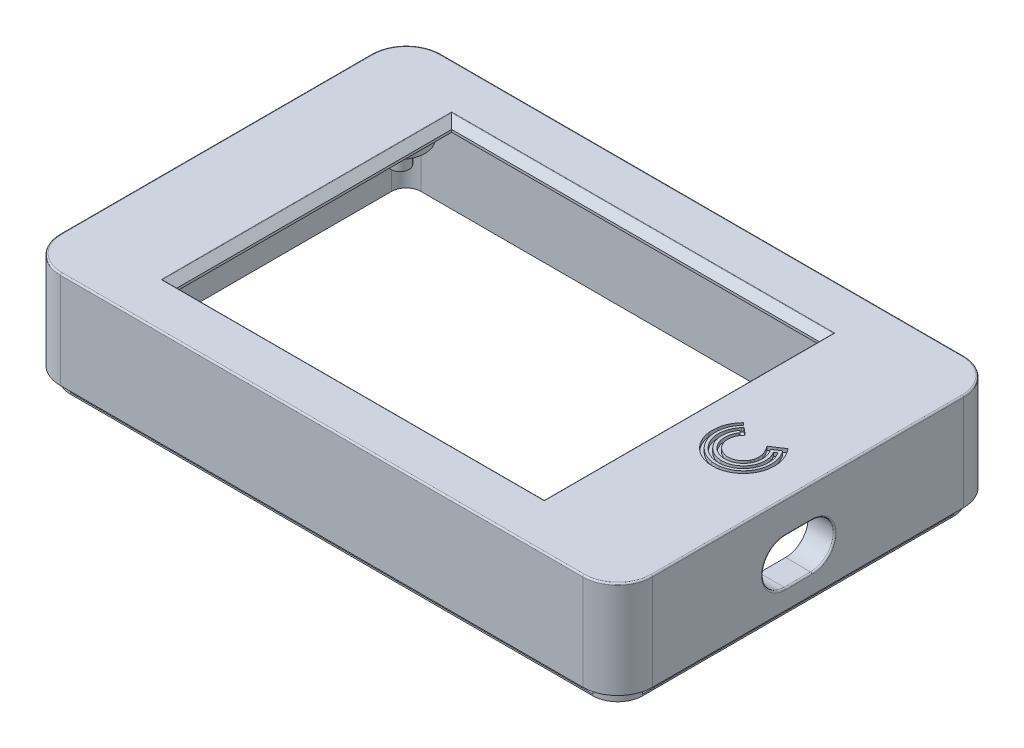
from build123d import *

# Parameters (mm, degrees)
ESQUISSE1_W                 = 92
ESQUISSE1_H                 = 58
ESQUISSE1_W_2               = 59.1
ESQUISSE1_H_2               = 44.2
BOSS_EXTRU_1_DEPTH          = 1.6
CONG_1_R                    = 4
CHANFREIN1_SIZE             = 1.2
ESQUISSE12_R                = 4
BOSS_EXTRU_2_DEPTH          = 4
ESQUISSE13_R                = 1.45
BOSS_EXTRU_3_DEPTH          = 7.5
EXTRU_MINCE3_DEPTH          = 16
EXTRU_MINCE4_DEPTH          = 14
EXTRU_MINCE4_DEPTH_BACK     = 1.6
ENL_V_MAT_EXTRU_3_OK_DEPTH  = 50
ENL_V_MAT_EXTRU_4_OK_DEPTH  = 50
ENL_V_MAT_EXTRU_5_DEPTH     = 84
ENL_V_MAT_EXTRU_8_DEPTH     = 0.6
EXTRU_MINCE5_DEPTH          = 4.25
ENL_V_MAT_EXTRU_11_OK_DEPTH = 4
ENL_V_MAT_EXTRU_15_DEPTH    = 84
CONG_2_R                    = 1
CONG_3_R                    = 0.25
CONG_4_R                    = 0.25
CONG_5_R                    = 0.125


with BuildPart() as part:
    # Esquisse1 → Boss.-Extru.1 (new body)
    with BuildSketch(Plane(origin=(0, 0, 0), x_dir=(1, 0, 0), z_dir=(0, 1, 0))):
        Rectangle(ESQUISSE1_W, ESQUISSE1_H)
        with Locations((-2.25, 0)):
            Rectangle(ESQUISSE1_W_2, ESQUISSE1_H_2, mode=Mode.SUBTRACT)
    extrude(amount=BOSS_EXTRU_1_DEPTH)

    # Congé1
    cong_1_edges = [part.edges().sort_by_distance(p)[0] for p in [
        (46, 0.8, 29),
        (-46, 0.8, 29),
        (-46, 0.8, -29),
        (46, 0.8, -29),
    ]]
    fillet(cong_1_edges, radius=CONG_1_R)

    # Chanfrein1
    chanfrein1_edges = [part.edges().sort_by_distance(p)[0] for p in [
        (27.3, 1.6, 0),
        (-2.25, 1.6, -22.1),
        (-31.8, 1.6, 0),
        (-2.25, 1.6, 22.1),
    ]]
    chamfer(chanfrein1_edges, length=CHANFREIN1_SIZE)

    # Esquisse12 → Boss.-Extru.2 (add)
    with BuildSketch(Plane.XZ):
        with Locations(Location((-39, 21, 0), (0, 0, 90))):
            Circle(ESQUISSE12_R)
        with Locations(Location((-39, -21, 0), (0, 0, 90))):
            Circle(ESQUISSE12_R)
        with Locations(Location((39, 21, 0), (0, 0, 90))):
            Circle(ESQUISSE12_R)
        with Locations(Location((39, -21, 0), (0, 0, 90))):
            Circle(ESQUISSE12_R)
    extrude(amount=BOSS_EXTRU_2_DEPTH)

    # Esquisse13 → Boss.-Extru.3 (add)
    with BuildSketch(Plane.XZ):
        with Locations(Location((-39, 21, 0), (0, 0, 270))):
            Circle(ESQUISSE13_R)
        with Locations(Location((-39, -21, 0), (0, 0, 270))):
            Circle(ESQUISSE13_R)
        with Locations(Location((39, -21, 0), (0, 0, 270))):
            Circle(ESQUISSE13_R)
        with Locations(Location((39, 21, 0), (0, 0, 270))):
            Circle(ESQUISSE13_R)
    extrude(amount=BOSS_EXTRU_3_DEPTH)

    # Esquisse32 → Extru.-Mince3 (add)
    with BuildSketch(Plane.XZ):
        with BuildLine():
            Line((46, -25), (46, 25))
            ThreePointArc((46, 25), (44.828427125, 27.828427125), (42, 29))
            Line((42, 29), (-42, 29))
            ThreePointArc((-42, 29), (-44.828427125, 27.828427125), (-46, 25))
            Line((-46, 25), (-46, -25))
            ThreePointArc((-46, -25), (-44.828427125, -27.828427125), (-42, -29))
            Line((-42, -29), (42, -29))
            ThreePointArc((42, -29), (44.828427125, -27.828427125), (46, -25))
        make_face()
        with BuildLine():
            Line((44.4, -25), (44.4, 25))
            ThreePointArc((44.4, 25), (43.697056275, 26.697056275), (42, 27.4))
            Line((42, 27.4), (-42, 27.4))
            ThreePointArc((-42, 27.4), (-43.697056275, 26.697056275), (-44.4, 25))
            Line((-44.4, 25), (-44.4, -25))
            ThreePointArc((-44.4, -25), (-43.697056275, -26.697056275), (-42, -27.4))
            Line((-42, -27.4), (42, -27.4))
            ThreePointArc((42, -27.4), (43.697056275, -26.697056275), (44.4, -25))
        make_face(mode=Mode.SUBTRACT)
    extrude(amount=EXTRU_MINCE3_DEPTH)

    # Esquisse32<2> → Extru.-Mince4 (add, two sides: drawn at the far end of the back side and taken through both)
    with BuildSketch(Plane.XZ.offset(-EXTRU_MINCE4_DEPTH_BACK)):
        with BuildLine():
            Line((47.6, -25), (47.6, 25))
            ThreePointArc((47.6, 25), (45.959797975, 28.959797975), (42, 30.6))
            Line((42, 30.6), (-42, 30.6))
            ThreePointArc((-42, 30.6), (-45.959797975, 28.959797975), (-47.6, 25))
            Line((-47.6, 25), (-47.6, -25))
            ThreePointArc((-47.6, -25), (-45.959797975, -28.959797975), (-42, -30.6))
            Line((-42, -30.6), (42, -30.6))
            ThreePointArc((42, -30.6), (45.959797975, -28.959797975), (47.6, -25))
        make_face()
        with BuildLine():
            Line((46, -25), (46, 25))
            ThreePointArc((46, 25), (44.828427125, 27.828427125), (42, 29))
            Line((42, 29), (-42, 29))
            ThreePointArc((-42, 29), (-44.828427125, 27.828427125), (-46, 25))
            Line((-46, 25), (-46, -25))
            ThreePointArc((-46, -25), (-44.828427125, -27.828427125), (-42, -29))
            Line((-42, -29), (42, -29))
            ThreePointArc((42, -29), (44.828427125, -27.828427125), (46, -25))
        make_face(mode=Mode.SUBTRACT)
    extrude(amount=EXTRU_MINCE4_DEPTH + EXTRU_MINCE4_DEPTH_BACK)

    # Esquisse3D2 → Enlèv. mat.-Extru.3 ok (cut)
    with BuildSketch(Plane(origin=(-46, -15, -25), x_dir=(0, -1, 0), z_dir=(0, 0, 1))):
        Polygon((0, 0), (0.75, 0), (0, 0.75), (-0.75, 0), align=None)
    extrude(amount=ENL_V_MAT_EXTRU_3_OK_DEPTH, mode=Mode.SUBTRACT)

    # Esquisse3D3 → Enlèv. mat.-Extru.4 ok (cut)
    with BuildSketch(Plane(origin=(46, -15, -25), x_dir=(0, -1, 0), z_dir=(0, 0, -1))):
        Polygon((0, 0), (0.75, 0), (0, 0.75), (-0.75, 0), align=None)
    extrude(amount=-ENL_V_MAT_EXTRU_4_OK_DEPTH, mode=Mode.SUBTRACT)

    # Esquisse3D4 → Enlèv. mat.-Extru.5 (cut)
    with BuildSketch(Plane(origin=(42, -15, 29), x_dir=(0, 1, 0), z_dir=(-1, 0, 0))):
        Polygon((0, 0), (0.75, 0), (0, 0.75), (-0.75, 0), align=None)
    extrude(amount=ENL_V_MAT_EXTRU_5_DEPTH, mode=Mode.SUBTRACT)

    # Esquisse45 → Enlèv. mat.-Extru.8 (cut)
    with BuildSketch(Plane(origin=(0, 1.6, 0), x_dir=(1, 0, 0), z_dir=(0, 1, 0))):
        with BuildLine():
            Line((34.215771039, 2.711268822), (34.388486911, 2.91272131))
            Line((34.388486911, 2.91272131), (34.437828255, 2.87228474))
            add(Edge.make_bspline(
                [(34.993798002, 2.403405668), (34.712606668, 2.63893908), (34.463374704, 2.848535174), (34.437828255, 2.87228474)],
                knots=[24, 24, 24, 24, 25, 25, 25, 25], degree=3))
            add(Edge.make_bspline(
                [(35.53485939, 1.947487739), (35.517838447, 1.964749217), (35.274989336, 2.167872256), (34.993798002, 2.403405668)],
                knots=[23, 23, 23, 23, 24, 24, 24, 24], degree=3))
            add(Edge.make_bspline(
                [(35.407029817, 1.746965484), (35.538753823, 1.891748736), (35.558278221, 1.925895857), (35.53485939, 1.947487739)],
                knots=[22, 22, 22, 22, 23, 23, 23, 23], degree=3))
            add(Edge.make_bspline(
                [(34.73787057, 0.131736327), (34.772257454, 0.757180054), (34.985875379, 1.274228405), (35.407029817, 1.746965484)],
                knots=[21, 21, 21, 21, 22, 22, 22, 22], degree=3))
            add(Edge.make_bspline(
                [(34.824246771, -0.689545579), (34.744825467, -0.404001679), (34.720662095, -0.183128188), (34.73787057, 0.131736327)],
                knots=[20, 20, 20, 20, 21, 21, 21, 21], degree=3))
            add(Edge.make_bspline(
                [(35.655401606, -1.944604427), (35.261221021, -1.626853492), (34.962264203, -1.174776992), (34.824246771, -0.689545579)],
                knots=[19, 19, 19, 19, 20, 20, 20, 20], degree=3))
            add(Edge.make_bspline(
                [(39.451885494, -1.096996831), (38.741075896, -2.540513211), (36.903989716, -2.951889554), (35.655401606, -1.944604427)],
                knots=[18, 18, 18, 18, 19, 19, 19, 19], degree=3))
            add(Edge.make_bspline(
                [(39.626454625, -0.648242722), (39.593503049, -0.763720393), (39.514939423, -0.966731068), (39.451885494, -1.096996831)],
                knots=[17, 17, 17, 17, 18, 18, 18, 18], degree=3))
            add(Edge.make_bspline(
                [(39.68880121, -0.00799587), (39.686020024, -0.40438637), (39.681403985, -0.451494633), (39.626454625, -0.648242722)],
                knots=[16, 16, 16, 16, 17, 17, 17, 17], degree=3))
            add(Edge.make_bspline(
                [(39.63752714, 0.624477149), (39.687642863, 0.437705678), (39.691567363, 0.386251979), (39.68880121, -0.00799587)],
                knots=[15, 15, 15, 15, 16, 16, 16, 16], degree=3))
            add(Edge.make_bspline(
                [(39.035470632, 1.854358254), (39.381024576, 1.32481557), (39.537370861, 1.008733346), (39.63752714, 0.624477149)],
                knots=[14, 14, 14, 14, 15, 15, 15, 15], degree=3))
            add(Edge.make_bspline(
                [(38.840436356, 2.153569868), (38.905447781, 2.053832663), (38.970459207, 1.954095459), (39.035470632, 1.854358254)],
                knots=[13, 13, 13, 13, 14, 14, 14, 14], degree=3))
            add(Edge.make_bspline(
                [(39.834971581, 2.806561036), (39.503459839, 2.588897313), (39.171948097, 2.371233591), (38.840436356, 2.153569868)],
                knots=[12, 12, 12, 12, 13, 13, 13, 13], degree=3))
            add(Edge.make_bspline(
                [(40.853166171, 3.472242744), (40.84025013, 3.463762339), (40.381745676, 3.164850621), (39.834971581, 2.806561036)],
                knots=[11, 11, 11, 11, 12, 12, 12, 12], degree=3))
            add(Edge.make_bspline(
                [(41.322512824, 2.873263277), (41.110487671, 3.194021673), (40.881140907, 3.48918852), (40.853166171, 3.472242744)],
                knots=[10, 10, 10, 10, 11, 11, 11, 11], degree=3))
            add(Edge.make_bspline(
                [(42.164389591, 0.703172034), (42.039144997, 1.481871515), (41.75293095, 2.22313078), (41.322512824, 2.873263277)],
                knots=[9, 9, 9, 9, 10, 10, 10, 10], degree=3))
            add(Edge.make_bspline(
                [(42.153866183, -0.796683914), (42.211935368, -0.460678521), (42.215625692, 0.370685238), (42.164389591, 0.703172034)],
                knots=[8, 8, 8, 8, 9, 9, 9, 9], degree=3))
            add(Edge.make_bspline(
                [(41.861482067, -1.851011584), (41.977057069, -1.564693075), (42.095781964, -1.134831959), (42.153866183, -0.796683914)],
                knots=[7, 7, 7, 7, 8, 8, 8, 8], degree=3))
            add(Edge.make_bspline(
                [(39.359312247, -4.518329973), (40.505224046, -3.973538747), (41.381725142, -3.041161031), (41.861482067, -1.851011584)],
                knots=[6, 6, 6, 6, 7, 7, 7, 7], degree=3))
            add(Edge.make_bspline(
                [(38.017088329, -4.946034949), (38.532001159, -4.853223664), (38.903536749, -4.733693322), (39.359312247, -4.518329973)],
                knots=[5, 5, 5, 5, 6, 6, 6, 6], degree=3))
            add(Edge.make_bspline(
                [(36.598412598, -4.970365233), (36.900285903, -5.00676737), (37.772495339, -4.991459466), (38.017088329, -4.946034949)],
                knots=[4, 4, 4, 4, 5, 5, 5, 5], degree=3))
            add(Edge.make_bspline(
                [(34.115882809, -3.922281074), (34.823334364, -4.484361528), (35.722774766, -4.863511942), (36.598412598, -4.970365233)],
                knots=[3, 3, 3, 3, 4, 4, 4, 4], degree=3))
            add(Edge.make_bspline(
                [(33.303027532, -3.113044042), (33.492069824, -3.350073667), (33.879356418, -3.734201694), (34.115882809, -3.922281074)],
                knots=[2, 2, 2, 2, 3, 3, 3, 3], degree=3))
            add(Edge.make_bspline(
                [(32.263988871, -0.641583499), (32.360837793, -1.497222995), (32.750748881, -2.423486915), (33.303027532, -3.113044042)],
                knots=[1, 1, 1, 1, 2, 2, 2, 2], degree=3))
            add(Edge.make_bspline(
                [(32.233653114, -0.384239835), (32.237697881, -0.418552324), (32.251884635, -0.534360731), (32.263988871, -0.641583499)],
                knots=[0, 0, 0, 0, 1, 1, 1, 1], degree=3))
            add(Edge.make_bspline(
                [(32.282692015, 0.802503379), (32.249078968, 0.592749048), (32.213278941, -0.234103906), (32.233653114, -0.384239835)],
                knots=[69, 69, 69, 69, 70, 70, 70, 70], degree=3))
            add(Edge.make_bspline(
                [(33.541417478, 3.37783655), (32.863468483, 2.647627636), (32.443908362, 1.791325897), (32.282692015, 0.802503379)],
                knots=[68, 68, 68, 68, 69, 69, 69, 69], degree=3))
            add(Edge.make_bspline(
                [(33.677456854, 3.526875038), (33.632110396, 3.477195542), (33.586763937, 3.427516046), (33.541417478, 3.37783655)],
                knots=[67, 67, 67, 67, 68, 68, 68, 68], degree=3))
            add(Edge.make_bspline(
                [(33.800978961, 3.418870531), (33.759804925, 3.454872033), (33.71863089, 3.490873536), (33.677456854, 3.526875038)],
                knots=[66, 66, 66, 66, 67, 67, 67, 67], degree=3))
            add(Edge.make_bspline(
                [(34.001155446, 3.241759977), (33.95643037, 3.280643403), (33.866980217, 3.358410256), (33.800978961, 3.418870531)],
                knots=[65, 65, 65, 65, 66, 66, 66, 66], degree=3))
            add(Edge.make_bspline(
                [(34.077809825, 3.172653929), (34.052258365, 3.195689278), (34.026706906, 3.218724627), (34.001155446, 3.241759977)],
                knots=[64, 64, 64, 64, 65, 65, 65, 65], degree=3))
            add(Edge.make_bspline(
                [(33.967737833, 3.059860113), (34.004428497, 3.097458052), (34.041119161, 3.135055991), (34.077809825, 3.172653929)],
                knots=[63, 63, 63, 63, 64, 64, 64, 64], degree=3))
            add(Edge.make_bspline(
                [(32.759384434, -0.276505158), (32.680375392, 0.983990209), (33.11305412, 2.183040998), (33.967737833, 3.059860113)],
                knots=[62, 62, 62, 62, 63, 63, 63, 63], degree=3))
            add(Edge.make_bspline(
                [(36.47798738, -4.420974547), (34.41703451, -4.061530476), (32.890472222, -2.360184548), (32.759384434, -0.276505158)],
                knots=[61, 61, 61, 61, 62, 62, 62, 62], degree=3))
            add(Edge.make_bspline(
                [(37.720574831, -4.451120456), (37.379577563, -4.493725817), (36.805422167, -4.478983598), (36.47798738, -4.420974547)],
                knots=[60, 60, 60, 60, 61, 61, 61, 61], degree=3))
            add(Edge.make_bspline(
                [(40.604754507, -2.920000719), (39.885253263, -3.769912474), (38.855044637, -4.315515505), (37.720574831, -4.451120456)],
                knots=[59, 59, 59, 59, 60, 60, 60, 60], degree=3))
            add(Edge.make_bspline(
                [(41.321123389, 1.759039473), (41.993444292, 0.160111198), (41.723953608, -1.601486853), (40.604754507, -2.920000719)],
                knots=[58, 58, 58, 58, 59, 59, 59, 59], degree=3))
            add(Edge.make_bspline(
                [(40.749598074, 2.759431381), (40.805307009, 2.759040512), (41.167280559, 2.126530295), (41.321123389, 1.759039473)],
                knots=[57, 57, 57, 57, 58, 58, 58, 58], degree=3))
            add(Edge.make_bspline(
                [(40.149122393, 2.38223377), (40.467708071, 2.589988654), (40.738884817, 2.759506548), (40.749598074, 2.759431381)],
                knots=[56, 56, 56, 56, 57, 57, 57, 57], degree=3))
            add(Edge.make_bspline(
                [(39.57008826, 2.007028476), (39.763099638, 2.132096907), (39.956111016, 2.257165339), (40.149122393, 2.38223377)],
                knots=[55, 55, 55, 55, 56, 56, 56, 56], degree=3))
            add(Edge.make_bspline(
                [(39.697143998, 1.791861334), (39.654792085, 1.863583715), (39.612440173, 1.935306095), (39.57008826, 2.007028476)],
                knots=[54, 54, 54, 54, 55, 55, 55, 55], degree=3))
            add(Edge.make_bspline(
                [(40.189850119, 0.552033678), (40.121848644, 0.938207025), (39.957623292, 1.352911345), (39.697143998, 1.791861334)],
                knots=[53, 53, 53, 53, 54, 54, 54, 54], degree=3))
            add(Edge.make_bspline(
                [(40.173086289, -0.615651176), (40.235095008, -0.328956831), (40.245581991, 0.249513934), (40.189850119, 0.552033678)],
                knots=[52, 52, 52, 52, 53, 53, 53, 53], degree=3))
            add(Edge.make_bspline(
                [(37.795227445, -2.973142025), (39.00338927, -2.718059735), (39.905331581, -1.824430145), (40.173086289, -0.615651176)],
                knots=[51, 51, 51, 51, 52, 52, 52, 52], degree=3))
            add(Edge.make_bspline(
                [(37.291373641, -3.016747496), (37.482114712, -3.011657518), (37.705100787, -2.991794483), (37.795227445, -2.973142025)],
                knots=[50, 50, 50, 50, 51, 51, 51, 51], degree=3))
            add(Edge.make_bspline(
                [(36.349388784, -2.898714912), (36.689393845, -2.99752454), (36.912034151, -3.026942485), (37.291373641, -3.016747496)],
                knots=[49, 49, 49, 49, 50, 50, 50, 50], degree=3))
            add(Edge.make_bspline(
                [(35.420567635, -2.431505324), (35.642245801, -2.598052956), (36.092781759, -2.824060753), (36.349388784, -2.898714912)],
                knots=[48, 48, 48, 48, 49, 49, 49, 49], degree=3))
            add(Edge.make_bspline(
                [(34.340556672, -0.913284099), (34.529261097, -1.503866231), (34.923900588, -2.061609151), (35.420567635, -2.431505324)],
                knots=[47, 47, 47, 47, 48, 48, 48, 48], degree=3))
            add(Edge.make_bspline(
                [(34.690888161, 1.681279159), (34.209897723, 0.926118003), (34.074318025, -0.073598173), (34.340556672, -0.913284099)],
                knots=[46, 46, 46, 46, 47, 47, 47, 47], degree=3))
            add(Edge.make_bspline(
                [(34.807899243, 1.866878021), (34.80788421, 1.864735369), (34.755874273, 1.781532769), (34.690888161, 1.681279159)],
                knots=[45, 45, 45, 45, 46, 46, 46, 46], degree=3))
            add(Edge.make_bspline(
                [(34.633269207, 2.020239009), (34.72913228, 1.940284404), (34.80792931, 1.871163323), (34.807899243, 1.866878021)],
                knots=[44, 44, 44, 44, 45, 45, 45, 45], degree=3))
            add(Edge.make_bspline(
                [(34.460736721, 2.16715701), (34.51824755, 2.118184343), (34.575758378, 2.069211676), (34.633269207, 2.020239009)],
                knots=[43, 43, 43, 43, 44, 44, 44, 44], degree=3))
            add(Edge.make_bspline(
                [(34.408877119, 2.105380923), (34.426163653, 2.125972952), (34.443450187, 2.146564981), (34.460736721, 2.16715701)],
                knots=[42, 42, 42, 42, 43, 43, 43, 43], degree=3))
            add(Edge.make_bspline(
                [(34.033658336, 1.460900999), (34.118574748, 1.653153317), (34.318104023, 1.994594457), (34.408877119, 2.105380923)],
                knots=[41, 41, 41, 41, 42, 42, 42, 42], degree=3))
            add(Edge.make_bspline(
                [(33.719224204, 0.012460781), (33.722907397, 0.537410363), (33.81807816, 0.969579499), (34.033658336, 1.460900999)],
                knots=[40, 40, 40, 40, 41, 41, 41, 41], degree=3))
            add(Edge.make_bspline(
                [(34.721837792, -2.458744193), (34.055878352, -1.785531504), (33.712534323, -0.941019071), (33.719224204, 0.012460781)],
                knots=[39, 39, 39, 39, 40, 40, 40, 40], degree=3))
            add(Edge.make_bspline(
                [(35.640600025, -3.138016131), (35.290422912, -2.961995887), (35.026087154, -2.767293119), (34.721837792, -2.458744193)],
                knots=[38, 38, 38, 38, 39, 39, 39, 39], degree=3))
            add(Edge.make_bspline(
                [(37.073650814, -3.508053964), (36.52741002, -3.484936574), (36.116757599, -3.377060237), (35.640600025, -3.138016131)],
                knots=[37, 37, 37, 37, 38, 38, 38, 38], degree=3))
            add(Edge.make_bspline(
                [(39.673490037, -2.495629125), (38.950650598, -3.210523778), (38.07615608, -3.551514687), (37.073650814, -3.508053964)],
                knots=[36, 36, 36, 36, 37, 37, 37, 37], degree=3))
            add(Edge.make_bspline(
                [(40.527060504, -1.166680507), (40.349972886, -1.668985867), (40.074834443, -2.097749542), (39.673490037, -2.495629125)],
                knots=[35, 35, 35, 35, 36, 36, 36, 36], degree=3))
            add(Edge.make_bspline(
                [(40.321640618, 1.622487415), (40.776252183, 0.75576673), (40.850652317, -0.245422723), (40.527060504, -1.166680507)],
                knots=[34, 34, 34, 34, 35, 35, 35, 35], degree=3))
            add(Edge.make_bspline(
                [(40.211860802, 1.852546917), (40.207544887, 1.848292234), (40.256091041, 1.745092979), (40.321640618, 1.622487415)],
                knots=[33, 33, 33, 33, 34, 34, 34, 34], degree=3))
            add(Edge.make_bspline(
                [(40.646334261, 2.111209808), (40.629233692, 2.117746376), (40.267882172, 1.901475222), (40.211860802, 1.852546917)],
                knots=[32, 32, 32, 32, 33, 33, 33, 33], degree=3))
            add(Edge.make_bspline(
                [(41.056039605, 1.244847124), (40.984729876, 1.46818664), (40.686955793, 2.098072459), (40.646334261, 2.111209808)],
                knots=[31, 31, 31, 31, 32, 32, 32, 32], degree=3))
            add(Edge.make_bspline(
                [(41.238955796, 0.118635499), (41.229167388, 0.562253551), (41.18190174, 0.853995173), (41.056039605, 1.244847124)],
                knots=[30, 30, 30, 30, 31, 31, 31, 31], degree=3))
            add(Edge.make_bspline(
                [(41.018815918, -1.351917853), (41.193673944, -0.853862791), (41.252118844, -0.457856484), (41.238955796, 0.118635499)],
                knots=[29, 29, 29, 29, 30, 30, 30, 30], degree=3))
            add(Edge.make_bspline(
                [(40.001151815, -2.926437052), (40.449715538, -2.498755243), (40.809150796, -1.941909929), (41.018815918, -1.351917853)],
                knots=[28, 28, 28, 28, 29, 29, 29, 29], degree=3))
            add(Edge.make_bspline(
                [(34.756272455, -3.207299936), (36.332831097, -4.42477247), (38.549094757, -4.306672089), (40.001151815, -2.926437052)],
                knots=[27, 27, 27, 27, 28, 28, 28, 28], degree=3))
            add(Edge.make_bspline(
                [(34.215771039, 2.711268822), (32.654499646, 0.890231739), (32.897852252, -1.770333077), (34.756272455, -3.207299936)],
                knots=[26, 26, 26, 26, 27, 27, 27, 27], degree=3))
        make_face()
    extrude(amount=-ENL_V_MAT_EXTRU_8_DEPTH, mode=Mode.SUBTRACT)

    # Esquisse48 → Extru.-Mince5 (add)
    with BuildSketch(Plane(origin=(47.6, 0, 0), x_dir=(0, 0, -1), z_dir=(1, 0, 0))):
        with BuildLine():
            Line((-3.625, -2.625), (0.625, -2.625))
            ThreePointArc((0.625, -2.625), (5.25, -7.25), (0.625, -11.875))
            Line((0.625, -11.875), (-3.625, -11.875))
            ThreePointArc((-3.625, -11.875), (-8.25, -7.25), (-3.625, -2.625))
        make_face()
        with BuildLine():
            Line((-3.625, -3.625), (0.625, -3.625))
            ThreePointArc((0.625, -3.625), (4.25, -7.25), (0.625, -10.875))
            Line((0.625, -10.875), (-3.625, -10.875))
            ThreePointArc((-3.625, -10.875), (-7.25, -7.25), (-3.625, -3.625))
        make_face(mode=Mode.SUBTRACT)
    extrude(amount=-EXTRU_MINCE5_DEPTH)

    # Esquisse48<2> → Enlèv. mat.-Extru.11 ok (cut)
    with BuildSketch(Plane(origin=(47.6, 0, 0), x_dir=(0, 0, -1), z_dir=(1, 0, 0))):
        with BuildLine():
            Line((0.625, -10.875), (-3.625, -10.875))
            ThreePointArc((-3.625, -10.875), (-7.25, -7.25), (-3.625, -3.625))
            Line((-3.625, -3.625), (0.625, -3.625))
            ThreePointArc((0.625, -3.625), (4.25, -7.25), (0.625, -10.875))
        make_face()
    extrude(amount=-ENL_V_MAT_EXTRU_11_OK_DEPTH, mode=Mode.SUBTRACT)

    # Esquisse3D6 → Enlèv. mat.-Extru.15 (cut)
    with BuildSketch(Plane(origin=(-42, -15, -29), x_dir=(0, -1, 0), z_dir=(-1, 0, 0))):
        Polygon((0, 0), (0.75, 0), (0, 0.75), (-0.75, 0), align=None)
    extrude(amount=-ENL_V_MAT_EXTRU_15_DEPTH, mode=Mode.SUBTRACT)

    # Congé2
    cong_2_edges = [part.edges().sort_by_distance(p)[0] for p in [
        (-39, 0, -25),
        (-39, 0, 17),
        (39, 0, -25),
        (39, 0, 17),
    ]]
    fillet(cong_2_edges, radius=CONG_2_R)

    # Congé3
    cong_3_edges = [part.edges().sort_by_distance(p)[0] for p in [
        (45.959797975, 1.6, 28.959797975),
        (47.6, 1.6, 0),
        (45.959797975, 1.6, -28.959797975),
        (0, 1.6, -30.6),
        (-45.959797975, 1.6, -28.959797975),
        (-47.6, 1.6, 0),
        (-45.959797975, 1.6, 28.959797975),
        (0, 1.6, 30.6),
    ]]
    fillet(cong_3_edges, radius=CONG_3_R)

    # Congé4
    cong_4_edges = [part.edges().sort_by_distance(p)[0] for p in [
        (47.6, -7.25, -4.25),
        (47.6, -3.625, 1.5),
        (47.6, -7.25, 7.25),
        (47.6, -10.875, 1.5),
    ]]
    fillet(cong_4_edges, radius=CONG_4_R)

    # Congé5
    cong_5_edges = [part.edges().sort_by_distance(p)[0] for p in [
        (28.5, 1.6, 0),
        (-2.25, 1.6, 23.3),
        (-33, 1.6, 0),
        (-2.25, 1.6, -23.3),
    ]]
    fillet(cong_5_edges, radius=CONG_5_R)


solid = part.part
